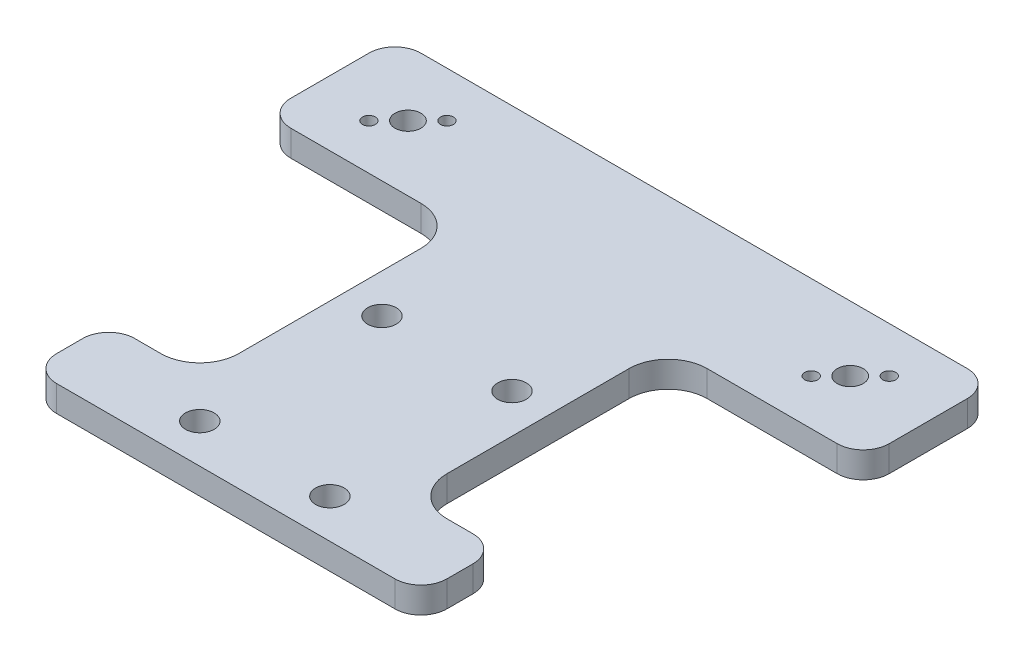
from build123d import *

# Parameters (mm, degrees)
AUFSATZ_LINEAR_AUSTRAGEN1_DEPTH  = 10
F_10_0_10_DURCHMESSER_BOHRUNG1_D = 10
F_5_0_5_DURCHMESSER_BOHRUNG1_D   = 5
DURCHGANGSLOCH_F_R_M101_D        = 11


with BuildPart() as part:
    # Skizze1 → Aufsatz-Linear austragen1 (new body)
    with BuildSketch(Plane(origin=(0, 0, 0), x_dir=(1, 0, 0), z_dir=(0, 1, 0))):
        with BuildLine():
            Line((-105, 90), (105, 90))
            ThreePointArc((105, 90), (112.071067812, 87.071067812), (115, 80))
            Line((115, 80), (115, 50))
            ThreePointArc((115, 50), (112.071067812, 42.928932188), (105, 40))
            Line((105, 40), (55, 40))
            ThreePointArc((55, 40), (44.393398282, 35.606601718), (40, 25))
            Line((40, 25), (40, -45))
            ThreePointArc((40, -45), (44.393398282, -55.606601718), (55, -60))
            Line((55, -60), (65, -60))
            ThreePointArc((65, -60), (72.071067812, -62.928932188), (75, -70))
            Line((75, -70), (75, -80))
            ThreePointArc((75, -80), (72.071067812, -87.071067812), (65, -90))
            Line((65, -90), (-65, -90))
            ThreePointArc((-65, -90), (-72.071067812, -87.071067812), (-75, -80))
            Line((-75, -80), (-75, -70))
            ThreePointArc((-75, -70), (-72.071067812, -62.928932188), (-65, -60))
            Line((-65, -60), (-55, -60))
            ThreePointArc((-55, -60), (-44.393398282, -55.606601718), (-40, -45))
            Line((-40, -45), (-40, 25))
            ThreePointArc((-40, 25), (-44.393398282, 35.606601718), (-55, 40))
            Line((-55, 40), (-105, 40))
            ThreePointArc((-105, 40), (-112.071067812, 42.928932188), (-115, 50))
            Line((-115, 50), (-115, 80))
            ThreePointArc((-115, 80), (-112.071067812, 87.071067812), (-105, 90))
        make_face()
    extrude(amount=AUFSATZ_LINEAR_AUSTRAGEN1_DEPTH)

    # Ø10.0 (10) Durchmesser Bohrung1 (through all)
    with Locations(Plane(origin=(0, 10, 0), x_dir=(1, 0, 0), z_dir=(0, 1, 0))):
        with Locations((-85, 65), (85, 65)):
            Hole(F_10_0_10_DURCHMESSER_BOHRUNG1_D / 2)

    # Ø5.0 (5) Durchmesser Bohrung1 (through all)
    with Locations(Plane(origin=(0, 0, 0), x_dir=(-1, 0, 0), z_dir=(0, -1, 0))):
        with Locations((77.5, 72.5), (92.5, 57.5), (-92.5, 72.5), (-77.5, 57.5)):
            Hole(F_5_0_5_DURCHMESSER_BOHRUNG1_D / 2)

    # Durchgangsloch für M101 (through all)
    with Locations(Plane(origin=(0, 0, 0), x_dir=(-1, 0, 0), z_dir=(0, -1, 0))):
        with Locations((-25, -5), (-25, -75), (25, -5), (25, -75)):
            Hole(DURCHGANGSLOCH_F_R_M101_D / 2)


solid = part.part
